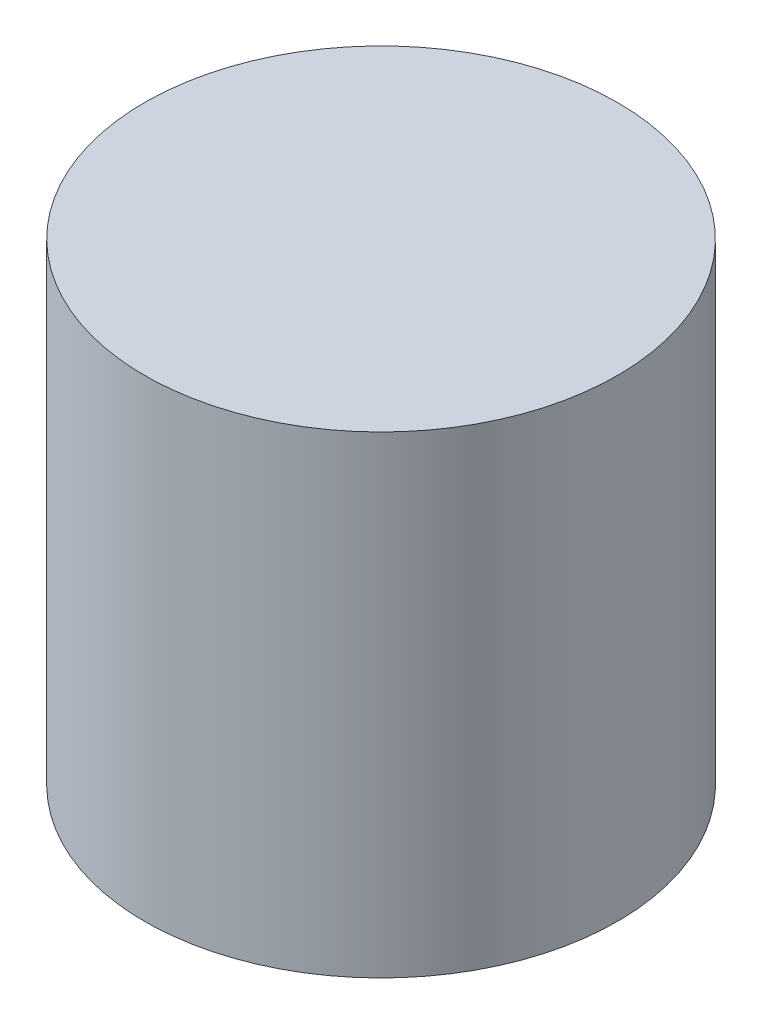
from build123d import *


with BuildPart() as part:
    # Schizzo1 → Rivoluzione1 (revolve)
    with BuildSketch(Plane.XY, mode=Mode.PRIVATE) as rivoluzione1_sk:
        Polygon((-14, 30), (0, 30), (0, 32), (-16, 32), (-16, 0), (-14, 0), align=None)
    revolve(rivoluzione1_sk.sketch.rotate(Axis((0, 0, 0), (0, 1, 0)), 270), axis=Axis((0, 0, 0), (0, 1, 0)))


solid = part.part
